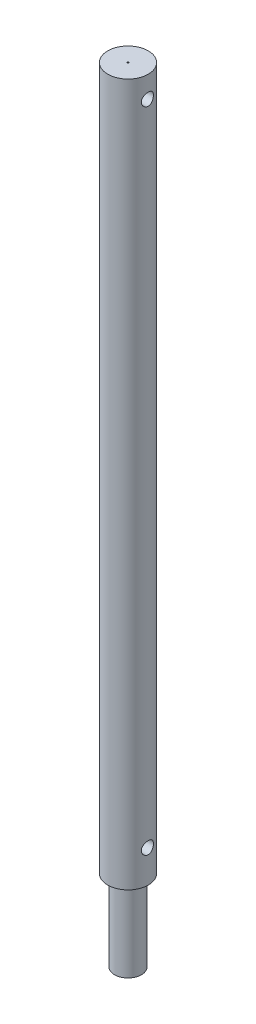
from build123d import *

# Parameters (mm, degrees)
ESQUISSE1_R             = 15
BOSS_EXTRU_1_DEPTH      = 650
ESQUISSE2_R             = 15
ESQUISSE2_R_2           = 10
ENL_V_MAT_EXTRU_1_DEPTH = 60
ESQUISSE3_R             = 2
ENL_V_MAT_EXTRU_2_DEPTH = 50
D_GAGEMENT_M81_D        = 9
ESQUISSE6_R             = 0.5
ENL_V_MAT_EXTRU_3_DEPTH = 580
ENL_V_START             = -70
ESQUISSE7_R             = 15
ENL_V_MAT_EXTRU_4_DEPTH = 70


with BuildPart() as part:
    # Esquisse1 → Boss.-Extru.1 (new body)
    with BuildSketch(Plane(origin=(0, 0, 0), x_dir=(1, 0, 0), z_dir=(0, 1, 0))):
        with Locations(Location((0, 0, 0), (0, 0, 270))):
            Circle(ESQUISSE1_R)
    extrude(amount=BOSS_EXTRU_1_DEPTH)

    # Esquisse2 → Enlèv. mat.-Extru.1 (cut)
    with BuildSketch(Plane(origin=(0, 0, 0), x_dir=(-1, 0, 0), z_dir=(0, -1, 0))):
        with Locations(Location((0, 0, 0), (0, 0, 90))):
            Circle(ESQUISSE2_R)
        with Locations(Location((0, 0, 0), (0, 0, 90))):
            Circle(ESQUISSE2_R_2, mode=Mode.SUBTRACT)
    extrude(amount=-ENL_V_MAT_EXTRU_1_DEPTH, mode=Mode.SUBTRACT)

    # Esquisse3 → Enlèv. mat.-Extru.2 (cut)
    with BuildSketch(Plane(origin=(0, 0, 0), x_dir=(-1, 0, 0), z_dir=(0, -1, 0))):
        with Locations(Location((0, 0, 0), (0, 0, 90))):
            Circle(ESQUISSE3_R)
    extrude(amount=-ENL_V_MAT_EXTRU_2_DEPTH, mode=Mode.SUBTRACT)

    # Dégagement M81 (through all)
    with Locations(Plane(origin=(-15, 84, 0), x_dir=(0, 0, -1), z_dir=(-1, 0, 0))):
        with Locations((0, 0), (0, -480)):
            Hole(D_GAGEMENT_M81_D / 2)

    # Esquisse6 → Enlèv. mat.-Extru.3 (cut)
    with BuildSketch(Plane(origin=(0, 650, 0), x_dir=(1, 0, 0), z_dir=(0, 1, 0))):
        with Locations(Location((0, 0, 0), (0, 0, 270))):
            Circle(ESQUISSE6_R)
    extrude(amount=-ENL_V_MAT_EXTRU_3_DEPTH, mode=Mode.SUBTRACT)

    # Esquisse7 → Enlèv. mat.-Extru.4 (cut)
    with BuildSketch(Plane(origin=(0, 650, 0), x_dir=(1, 0, 0), z_dir=(0, 1, 0)).offset(ENL_V_START)):
        with Locations(Location((0, 0, 0), (0, 0, 90))):
            Circle(ESQUISSE7_R)
    extrude(amount=ENL_V_MAT_EXTRU_4_DEPTH, mode=Mode.SUBTRACT)


solid = part.part
